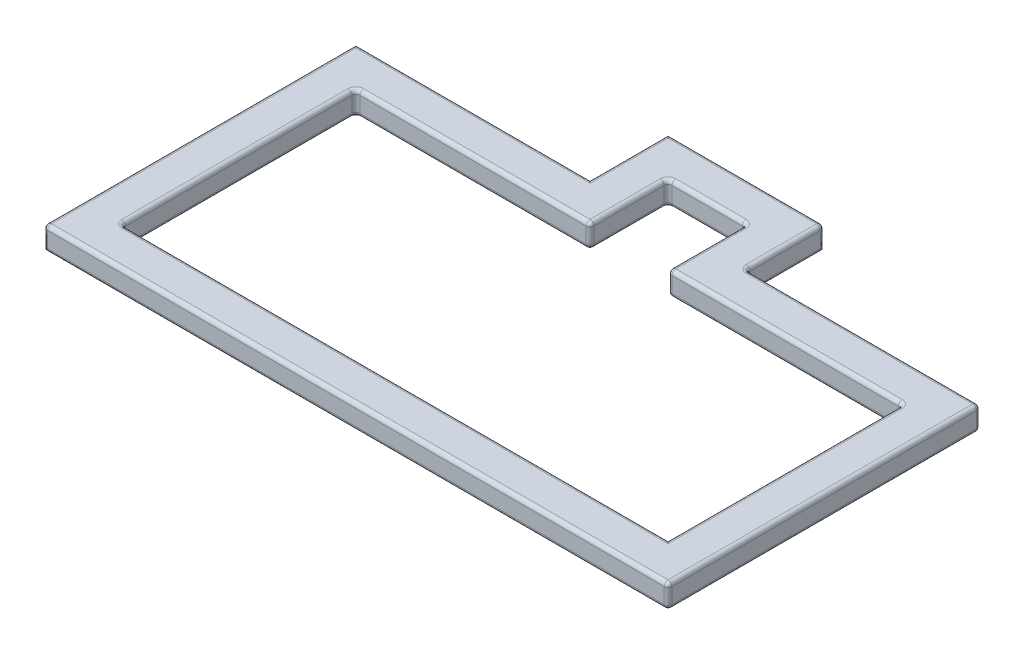
from build123d import *

# Parameters (mm, degrees)
BOSS_EXTRUDE4_DEPTH = 3
FILLET1_R           = 0.5


with BuildPart() as part:
    # Sketch1 → Boss-Extrude4 (new body)
    with BuildSketch(Plane(origin=(0, 0, 0), x_dir=(1, 0, 0), z_dir=(0, 1, 0))):
        Polygon((-369.811676083, 283.948122897), (-399.811676083, 283.948122897), (-399.811676083, 243.948122897), (-319.811676083, 243.948122897), (-319.811676083, 283.948122897), (-349.811676083, 283.948122897), (-354.811676083, 283.948122897), (-354.811676083, 278.948122897), (-324.811676083, 278.948122897), (-324.811676083, 248.948122897), (-394.811676083, 248.948122897), (-394.811676083, 278.948122897), (-364.811676083, 278.948122897), (-364.811676083, 283.948122897), align=None)
        Polygon((-369.811676083, 293.948122897), (-369.811676083, 283.948122897), (-364.811676083, 283.948122897), (-364.811676083, 288.948122897), (-354.811676083, 288.948122897), (-354.811676083, 283.948122897), (-349.811676083, 283.948122897), (-349.811676083, 293.948122897), align=None)
    extrude(amount=BOSS_EXTRUDE4_DEPTH)

    # Fillet1
    fillet1_edges = [part.edges().sort_by_distance(p)[0] for p in [
        (-349.811676083, 3, -288.948122897),
        (-359.811676083, 3, -293.948122897),
        (-364.811676083, 0, -283.948122897),
        (-379.811676083, 0, -278.948122897),
        (-394.811676083, 0, -263.948122897),
        (-369.811676083, 3, -288.948122897),
        (-359.811676083, 0, -248.948122897),
        (-324.811676083, 0, -263.948122897),
        (-339.811676083, 0, -278.948122897),
        (-354.811676083, 0, -283.948122897),
        (-359.811676083, 0, -288.948122897),
        (-319.811676083, 0, -263.948122897),
        (-359.811676083, 0, -243.948122897),
        (-384.811676083, 3, -283.948122897),
        (-349.811676083, 0, -288.948122897),
        (-334.811676083, 0, -283.948122897),
        (-399.811676083, 3, -263.948122897),
        (-364.811676083, 1.5, -288.948122897),
        (-364.811676083, 1.5, -278.948122897),
        (-394.811676083, 1.5, -278.948122897),
        (-359.811676083, 3, -243.948122897),
        (-394.811676083, 1.5, -248.948122897),
        (-324.811676083, 1.5, -278.948122897),
        (-354.811676083, 1.5, -278.948122897),
        (-354.811676083, 1.5, -288.948122897),
        (-319.811676083, 1.5, -283.948122897),
        (-319.811676083, 1.5, -243.948122897),
        (-399.811676083, 1.5, -243.948122897),
        (-349.811676083, 1.5, -293.948122897),
        (-349.811676083, 1.5, -283.948122897),
        (-319.811676083, 3, -263.948122897),
        (-359.811676083, 3, -288.948122897),
        (-354.811676083, 3, -283.948122897),
        (-339.811676083, 3, -278.948122897),
        (-334.811676083, 3, -283.948122897),
        (-324.811676083, 3, -263.948122897),
        (-359.811676083, 3, -248.948122897),
        (-394.811676083, 3, -263.948122897),
        (-379.811676083, 3, -278.948122897),
        (-364.811676083, 3, -283.948122897),
    ]]
    fillet(fillet1_edges, radius=FILLET1_R)


solid = part.part
